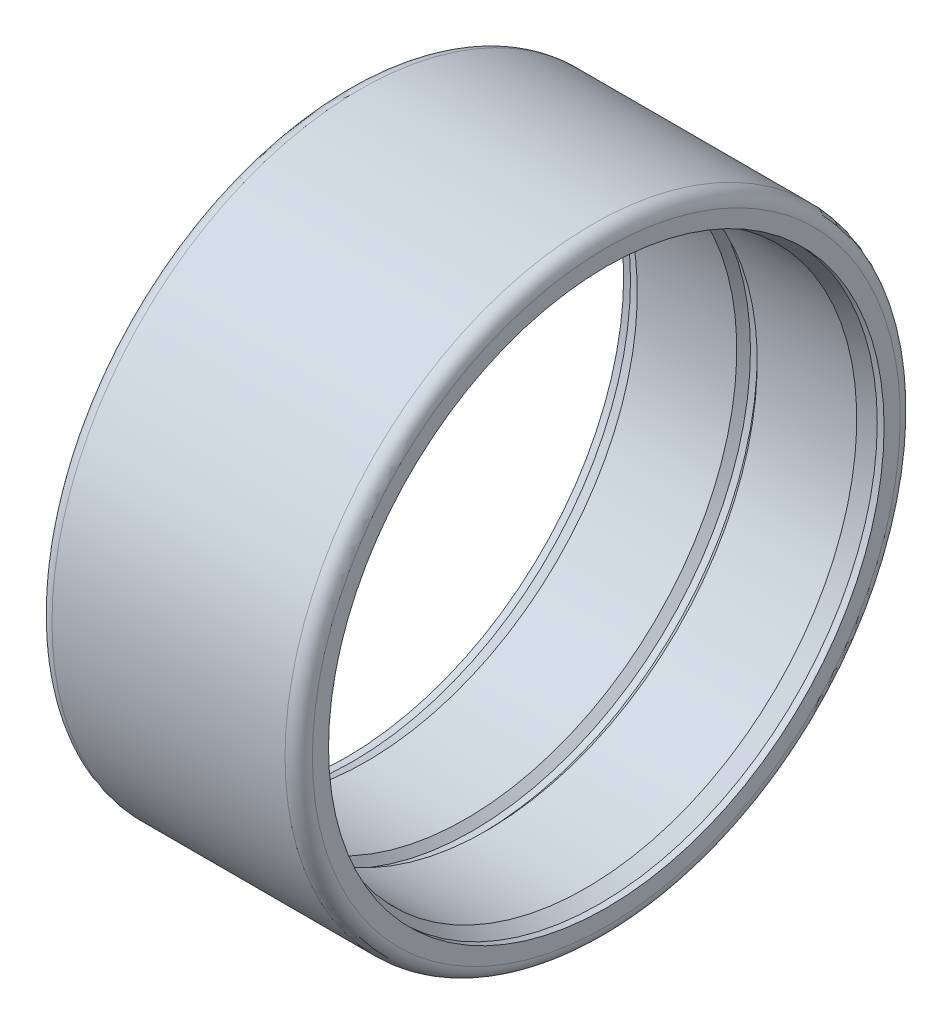
from build123d import *

# Parameters (mm, degrees)
FILLET1_R = 10


with BuildPart() as part:
    # Sketch1 → Revolve1 (revolve)
    with BuildSketch(Plane.XY, mode=Mode.PRIVATE) as revolve1_sk:
        Polygon((-7.5, 198.2), (-80.25, 198.2), (-90.25, 203.2), (-95.25, 203.2), (-95.25, 225), (95.25, 225), (95.25, 203.2), (90.25, 203.2), (80.25, 198.2), (7.5, 198.2), (2.5, 203.2), (-2.5, 203.2), align=None)
    revolve(revolve1_sk.sketch.rotate(Axis((-32.371311761, 0, 0), (1, 0, 0)), 90), axis=Axis((-32.371311761, 0, 0), (1, 0, 0)))

    # Fillet1
    fillet1_edges = [part.edges().sort_by_distance(p)[0] for p in [
        (-95.25, 0, -225),
        (95.25, 0, -225),
    ]]
    fillet(fillet1_edges, radius=FILLET1_R)


solid = part.part
